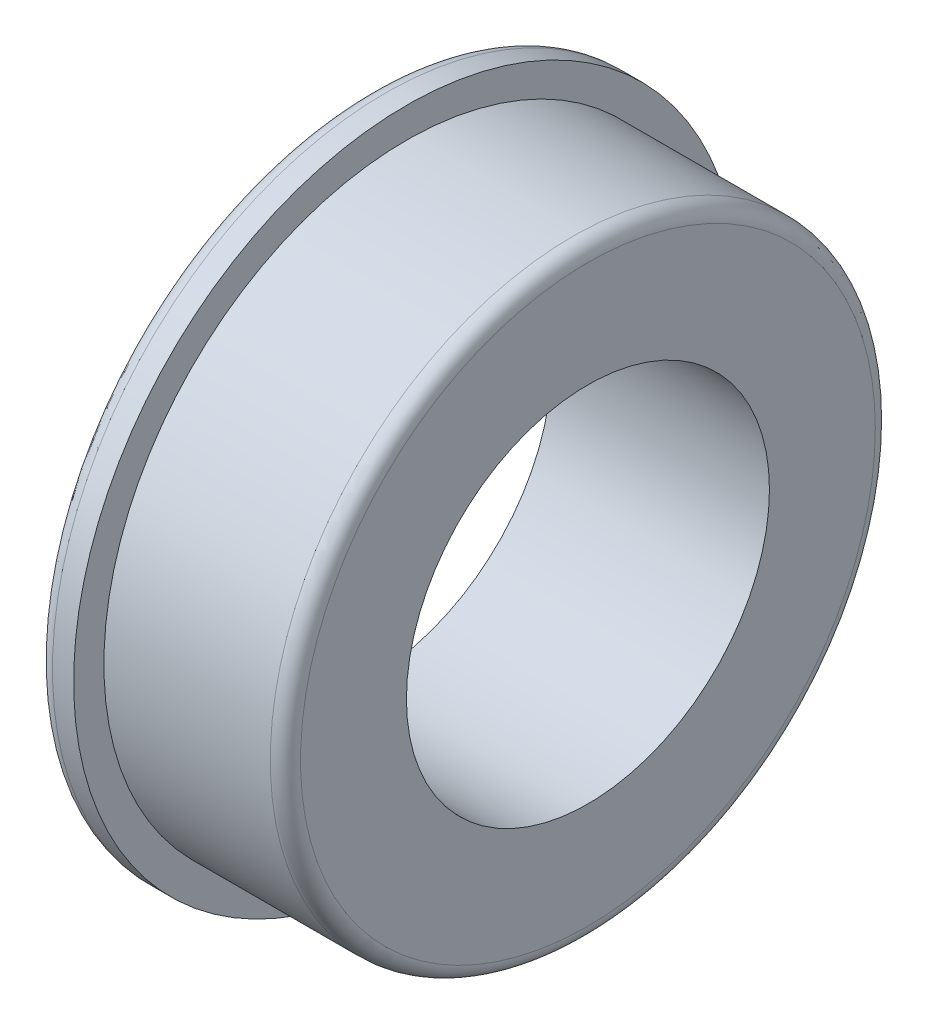
from build123d import *

# Parameters (mm, degrees)
SKETCH1_R           = 5.5
BOSS_EXTRUDE1_DEPTH = 0.6
SKETCH2_R           = 5
BOSS_EXTRUDE2_DEPTH = 3
SKETCH3_R           = 3
CUT_EXTRUDE1_DEPTH  = 9.570880935
SKETCH4_R           = 4.75
SKETCH4_R_2         = 4.375
CUT_EXTRUDE2_DEPTH  = 0.25
FILLET1_R           = 0.25
FILLET2_R           = 0.25


with BuildPart() as part:
    # Sketch1 → Boss-Extrude1 (new body)
    with BuildSketch(Plane(origin=(0, 0, 0), x_dir=(0, 0, -1), z_dir=(1, 0, 0))):
        Circle(SKETCH1_R)
    extrude(amount=BOSS_EXTRUDE1_DEPTH)

    # Sketch2 → Boss-Extrude2 (add)
    with BuildSketch(Plane(origin=(0.6, 0, 0), x_dir=(0, 0, -1), z_dir=(1, 0, 0))):
        Circle(SKETCH2_R)
    extrude(amount=BOSS_EXTRUDE2_DEPTH)

    # Sketch3 → Cut-Extrude1 (cut, through all)
    with BuildSketch(Plane(origin=(3.6, 0, 0), x_dir=(0, 0, -1), z_dir=(1, 0, 0))):
        Circle(SKETCH3_R)
    extrude(amount=-CUT_EXTRUDE1_DEPTH, mode=Mode.SUBTRACT)

    # Sketch4 → Cut-Extrude2 (cut)
    with BuildSketch(Plane.ZY):
        Circle(SKETCH4_R)
        Circle(SKETCH4_R_2, mode=Mode.SUBTRACT)
    extrude(amount=-CUT_EXTRUDE2_DEPTH, mode=Mode.SUBTRACT)

    # Fillet1
    fillet1_edges = [part.edges().sort_by_distance(p)[0] for p in [
        (0, 0, 5.5),
    ]]
    fillet(fillet1_edges, radius=FILLET1_R)

    # Fillet2
    fillet2_edges = [part.edges().sort_by_distance(p)[0] for p in [
        (3.6, 0, 5),
    ]]
    fillet(fillet2_edges, radius=FILLET2_R)


solid = part.part
